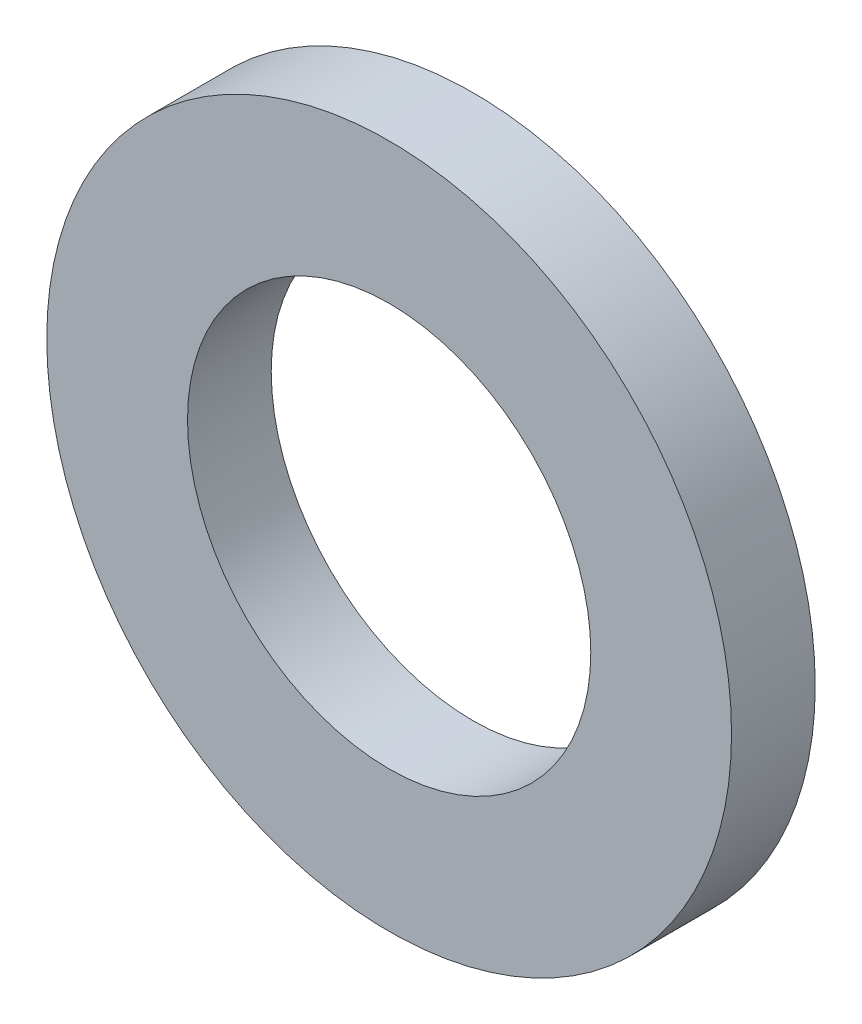
from build123d import *

# Parameters (mm, degrees)
SKETCH1_R           = 4.5
SKETCH1_R_2         = 2.65
BOSS_EXTRUDE1_DEPTH = 1.1


with BuildPart() as part:
    # Sketch1 → Boss-Extrude1 (new body)
    with BuildSketch(Plane.XY):
        Circle(SKETCH1_R)
        Circle(SKETCH1_R_2, mode=Mode.SUBTRACT)
    extrude(amount=BOSS_EXTRUDE1_DEPTH)


solid = part.part
